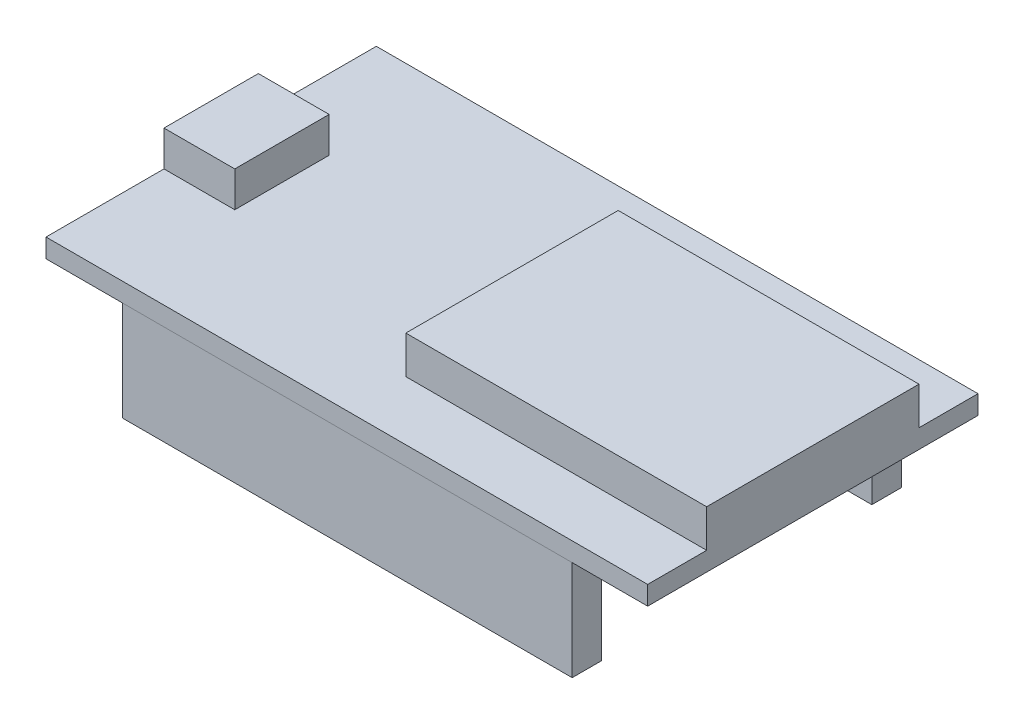
from build123d import *

# Parameters (mm, degrees)
SKETCH1_W          = 51
SKETCH1_H          = 28
BOARD_DEPTH        = 1.6
WROOM_MODULE_START = 1.6
SKETCH2_W          = 25.5
SKETCH2_H          = 18
WROOM_MODULE_DEPTH = 3.2
MICRO_USB_START    = 1.6
SKETCH3_W          = 6
SKETCH3_H          = 8
MICRO_USB_DEPTH    = 3
HEADER_A_START     = -8.5
SKETCH4_W          = 38.1
SKETCH4_H          = 2.5
HEADER_A_DEPTH     = 8.5
HEADER_B_START     = -8.5
SKETCH5_W          = 38.1
SKETCH5_H          = 2.5
HEADER_B_DEPTH     = 8.5


with BuildPart() as part:
    # Sketch1 → Board (new body)
    with BuildSketch(Plane(origin=(0, 0, 0), x_dir=(1, 0, 0), z_dir=(0, 1, 0))):
        Rectangle(SKETCH1_W, SKETCH1_H)
    extrude(amount=BOARD_DEPTH)

    # Sketch2 → WROOM_Module (add)
    with BuildSketch(Plane(origin=(0, 0, 0), x_dir=(1, 0, 0), z_dir=(0, 1, 0)).offset(WROOM_MODULE_START)):
        with Locations((12.75, 0)):
            Rectangle(SKETCH2_W, SKETCH2_H)
    extrude(amount=WROOM_MODULE_DEPTH)

    # Sketch3 → Micro_USB (add)
    with BuildSketch(Plane(origin=(0, 0, 0), x_dir=(1, 0, 0), z_dir=(0, 1, 0)).offset(MICRO_USB_START)):
        with Locations((-22.5, 0)):
            Rectangle(SKETCH3_W, SKETCH3_H)
    extrude(amount=MICRO_USB_DEPTH)

    # Sketch4 → Header_A (add)
    with BuildSketch(Plane(origin=(0, 0, 0), x_dir=(1, 0, 0), z_dir=(0, 1, 0)).offset(HEADER_A_START)):
        with Locations((0, 12.7)):
            Rectangle(SKETCH4_W, SKETCH4_H)
    extrude(amount=HEADER_A_DEPTH)

    # Sketch5 → Header_B (add)
    with BuildSketch(Plane(origin=(0, 0, 0), x_dir=(1, 0, 0), z_dir=(0, 1, 0)).offset(HEADER_B_START)):
        with Locations((0, -12.7)):
            Rectangle(SKETCH5_W, SKETCH5_H)
    extrude(amount=HEADER_B_DEPTH)


solid = part.part
